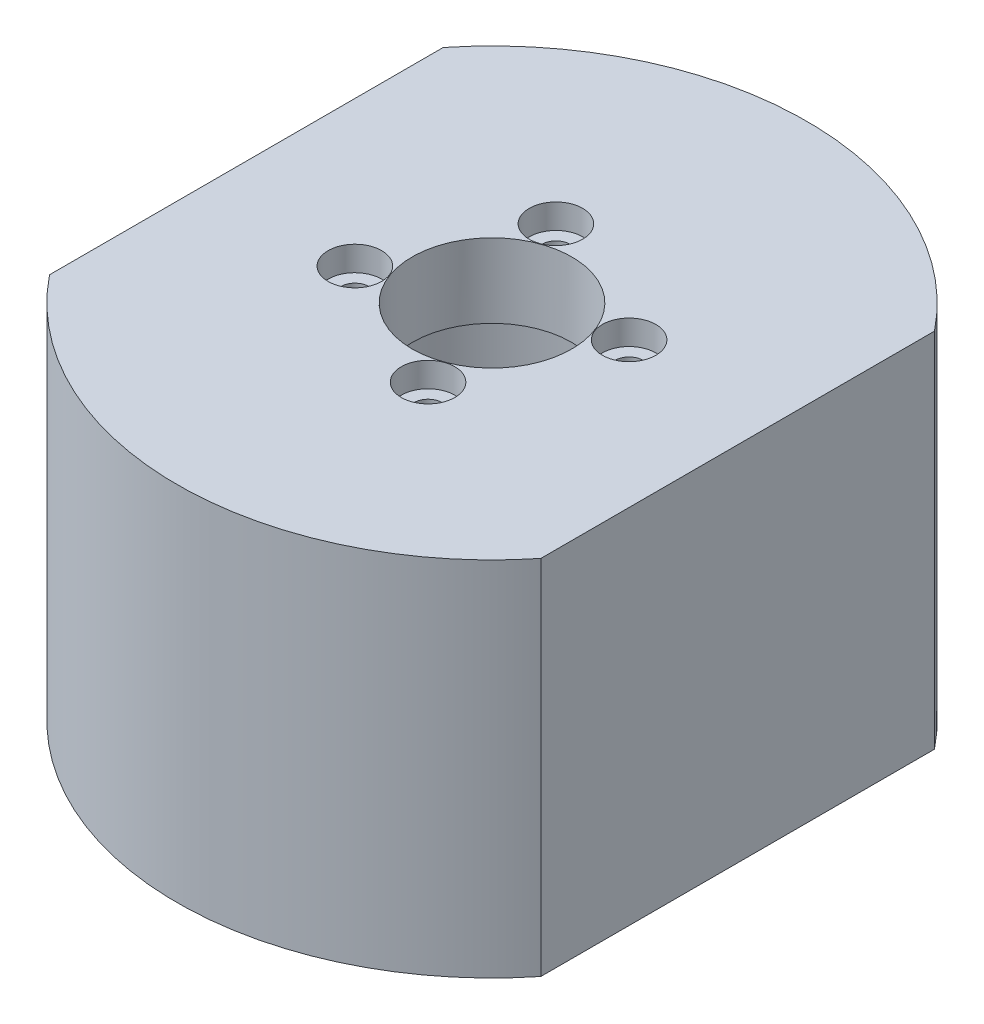
from build123d import *

# Parameters (mm, degrees)
BOSS_EXTRUDE1_DEPTH            = 44
CBORE_FOR_M3_SHCS1_D           = 3.4
CBORE_FOR_M3_SHCS1_CBORE_D     = 6.5
CBORE_FOR_M3_SHCS1_CBORE_DEPTH = 3
CIRPATTERN1_COUNT              = 4
SKETCH4_R                      = 16.2
CUT_EXTRUDE1_DEPTH             = 35
SKETCH5_R                      = 9.7
CUT_EXTRUDE2_DEPTH             = 66.498740446


with BuildPart() as part:
    # Sketch1 → Boss-Extrude1 (new body)
    with BuildSketch(Plane(origin=(0, 0, 0), x_dir=(1, 0, 0), z_dir=(0, 1, 0))):
        with BuildLine():
            Line((-29.85, 23.917357714), (-29.85, -23.917357714))
            ThreePointArc((-29.85, -23.917357714), (0, -38.25), (29.85, -23.917357714))
            Line((29.85, -23.917357714), (29.85, 23.917357714))
            ThreePointArc((29.85, 23.917357714), (0, 38.25), (-29.85, 23.917357714))
        make_face()
    extrude(amount=BOSS_EXTRUDE1_DEPTH)

    # CBORE for M3 SHCS1 (through all)
    with Locations(Plane(origin=(0, 44, 0), x_dir=(1, 0, 0), z_dir=(0, 1, 0))):
        with Locations((-4.446261863, 12.21600407)):
            cbore_for_m3_shcs1 = CounterBoreHole(CBORE_FOR_M3_SHCS1_D / 2, CBORE_FOR_M3_SHCS1_CBORE_D / 2, CBORE_FOR_M3_SHCS1_CBORE_DEPTH)

    # CirPattern1: CBORE for M3 SHCS1 ×4 about axis
    cirpattern1_axis = Axis((0, 44, 0), (0, -1, 0))
    for i in range(1, CIRPATTERN1_COUNT):
        add(cbore_for_m3_shcs1.rotate(cirpattern1_axis, i * 360 / CIRPATTERN1_COUNT), mode=Mode.SUBTRACT)

    # Sketch4 → Cut-Extrude1 (cut)
    with BuildSketch(Plane.XZ):
        Circle(SKETCH4_R)
    extrude(amount=-CUT_EXTRUDE1_DEPTH, mode=Mode.SUBTRACT)

    # Sketch5 → Cut-Extrude2 (cut, through all)
    with BuildSketch(Plane(origin=(0, 44, 0), x_dir=(1, 0, 0), z_dir=(0, 1, 0))):
        Circle(SKETCH5_R)
    extrude(amount=-CUT_EXTRUDE2_DEPTH, mode=Mode.SUBTRACT)


solid = part.part
